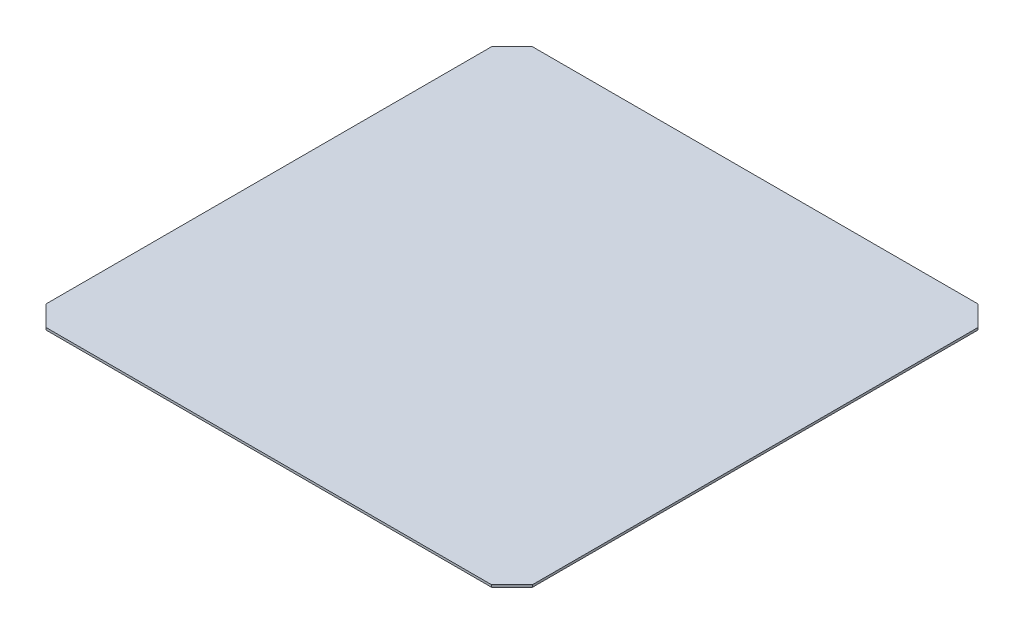
from build123d import *

# Parameters (mm, degrees)
BOSS_EXTRUDE1_DEPTH = 1
CHAMFER2_SIZE       = 9


with BuildPart() as part:
    # Sketch1 → Boss-Extrude1 (new body)
    with BuildSketch(Plane(origin=(0, 158.973467121, 0), x_dir=(1, 0, 0), z_dir=(0, 1, 0))):
        Polygon((127.936218841, -354.11857787), (191.936218841, -354.11857787), (197.936218841, -354.11857787), (197.936218841, -348.11857787), (197.936218841, -145.11857787), (197.936218841, -139.11857787), (191.936218841, -139.11857787), (-11.063781159, -139.11857787), (-17.063781159, -139.11857787), (-17.063781159, -145.11857787), (-17.063781159, -348.11857787), (-17.063781159, -354.11857787), (-11.063781159, -354.11857787), (52.936218841, -354.11857787), align=None)
    extrude(amount=BOSS_EXTRUDE1_DEPTH)

    # Chamfer2
    chamfer2_edges = [part.edges().sort_by_distance(p)[0] for p in [
        (-17.063781159, 159.473467121, 354.11857787),
        (-17.063781159, 159.473467121, 139.11857787),
        (197.936218841, 159.473467121, 139.11857787),
        (197.936218841, 159.473467121, 354.11857787),
    ]]
    chamfer(chamfer2_edges, length=CHAMFER2_SIZE)


solid = part.part
